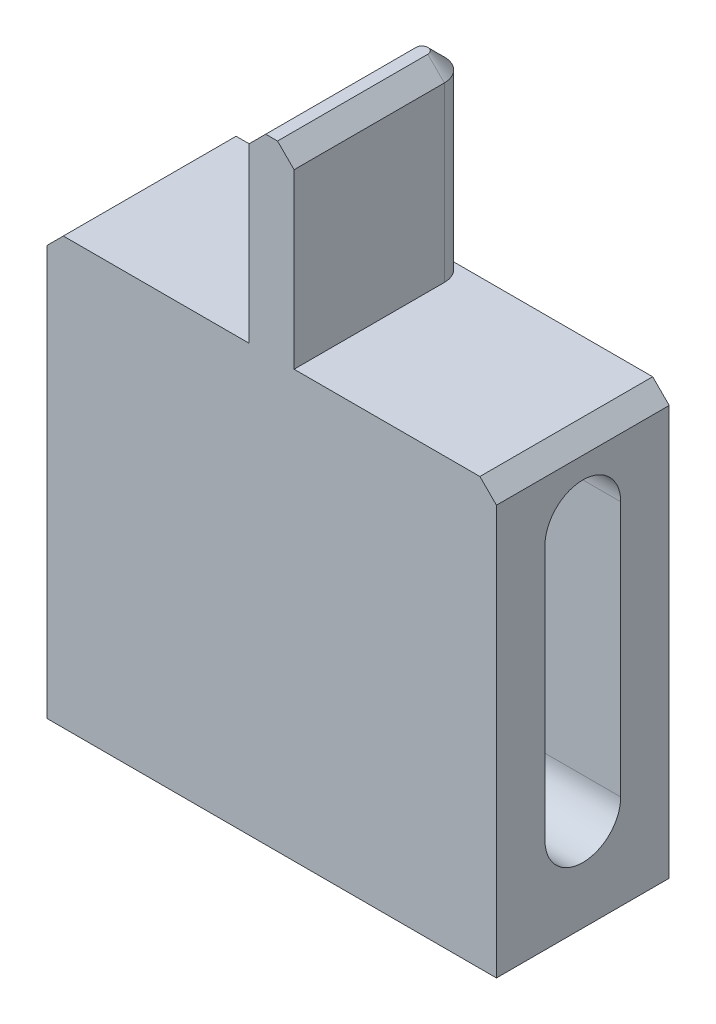
from build123d import *

# Parameters (mm, degrees)
BOSS_EXTRUDE1_DEPTH     = 7.3
CUT_EXTRUDE1_DEPTH      = 8
CUT_EXTRUDE2_DEPTH      = 8
CUT_EXTRUDE3_DEPTH      = 34.01953967
CUT_EXTRUDE3_DEPTH_BACK = 34.01953967
CHAMFER1_SIZE           = 0.7


with BuildPart() as part:
    # Sketch1 → Boss-Extrude1 (new body)
    with BuildSketch(Plane.XY):
        Polygon((0, 0), (19, 0), (19, 18), (10.45, 18), (10.45, 26), (8.55, 26), (8.55, 18), (0, 18), align=None)
    extrude(amount=BOSS_EXTRUDE1_DEPTH)

    # Sketch2 → Cut-Extrude1 (cut)
    with BuildSketch(Plane(origin=(0, 26, 0), x_dir=(1, 0, 0), z_dir=(0, 1, 0))):
        with BuildLine():
            Line((8.55, -0.95), (8.55, 0))
            Line((8.55, 0), (9.5, 0))
            ThreePointArc((9.5, 0), (8.828248558, -0.278248558), (8.55, -0.95))
        make_face()
    extrude(amount=-CUT_EXTRUDE1_DEPTH, mode=Mode.SUBTRACT)

    # Sketch3 → Cut-Extrude2 (cut)
    with BuildSketch(Plane(origin=(0, 26, 0), x_dir=(1, 0, 0), z_dir=(0, 1, 0))):
        with BuildLine():
            Line((9.5, 0), (10.45, 0))
            Line((10.45, 0), (10.45, -0.95))
            ThreePointArc((10.45, -0.95), (10.171751442, -0.278248558), (9.5, 0))
        make_face()
    extrude(amount=-CUT_EXTRUDE2_DEPTH, mode=Mode.SUBTRACT)

    # Sketch4 → Cut-Extrude3 (cut, two sides: drawn at the far end of the back side and taken through both)
    with BuildSketch(Plane(origin=(19, 0, 0), x_dir=(0, 0, -1), z_dir=(1, 0, 0)).offset(-CUT_EXTRUDE3_DEPTH_BACK)):
        with BuildLine():
            Line((-5.25, 14.8), (-5.25, 4))
            ThreePointArc((-5.25, 4), (-3.65, 2.4), (-2.05, 4))
            Line((-2.05, 4), (-2.05, 14.8))
            ThreePointArc((-2.05, 14.8), (-3.65, 16.4), (-5.25, 14.8))
        make_face()
    extrude(amount=CUT_EXTRUDE3_DEPTH + CUT_EXTRUDE3_DEPTH_BACK, mode=Mode.SUBTRACT)

    # Chamfer1
    chamfer1_edges = [part.edges().sort_by_distance(p)[0] for p in [
        (0, 18, 3.65),
        (8.55, 26, 4.125),
        (10.45, 26, 4.125),
        (19, 18, 3.65),
        (9.5, 26, 0),
    ]]
    chamfer(chamfer1_edges, length=CHAMFER1_SIZE)


solid = part.part
